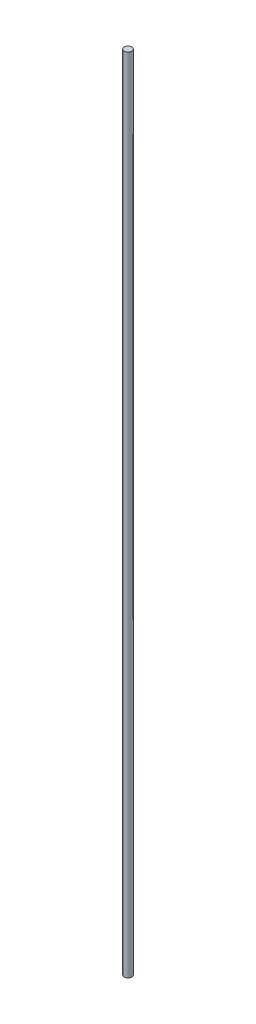
from build123d import *

# Parameters (mm, degrees)
SKETCH1_R           = 4.7625
BOSS_EXTRUDE1_DEPTH = 1016


with BuildPart() as part:
    # Sketch1 → Boss-Extrude1 (new body)
    with BuildSketch(Plane(origin=(0, 0, 0), x_dir=(1, 0, 0), z_dir=(0, 1, 0))):
        with Locations(Location((0, 0, 0), (0, 0, 270))):
            Circle(SKETCH1_R)
    extrude(amount=BOSS_EXTRUDE1_DEPTH)


solid = part.part
